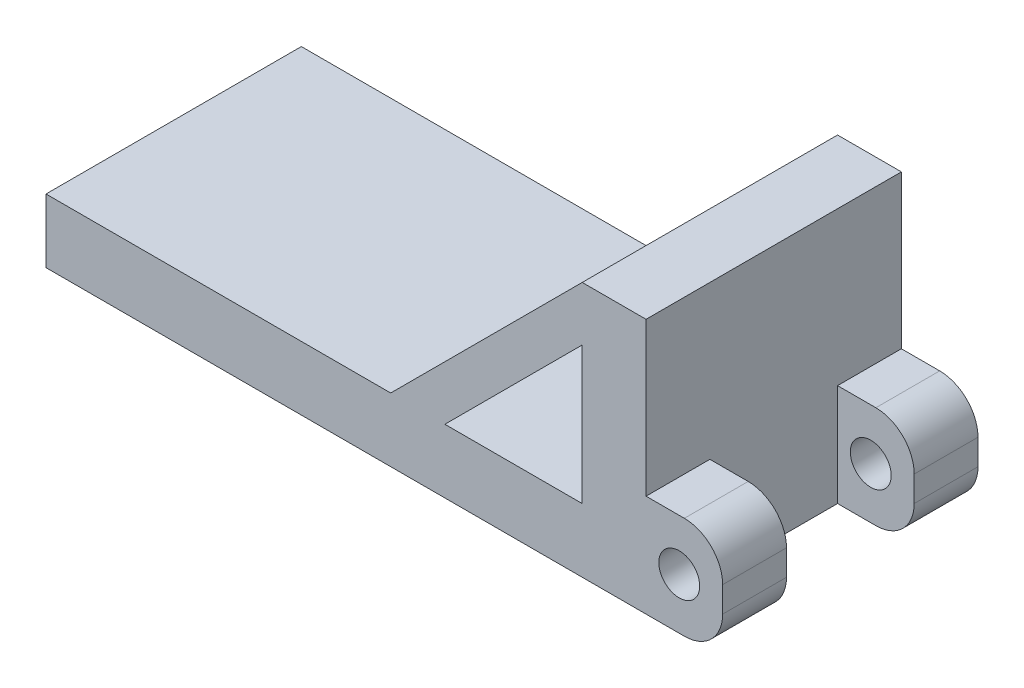
from build123d import *

# Parameters (mm, degrees)
SKETCH2_R           = 1.6
BOSS_EXTRUDE1_DEPTH = 20
FILLET1_R           = 3
CUT_EXTRUDE1_REACH  = 52.685
SKETCH3_W           = 6
SKETCH3_H           = 10


with BuildPart() as part:
    # Sketch2 → Boss-Extrude1 (new body)
    with BuildSketch(Plane.XY):
        Polygon((-45, 0), (0, 0), (8, 0), (8, 8), (2, 8), (2, 20), (-3, 20), (-18, 5), (-45, 5), align=None)
        with Locations((4.6, 4)):
            Circle(SKETCH2_R, mode=Mode.SUBTRACT)
        Polygon((-3, 5), (-13.757359313, 5), (-3, 15.757359313), align=None, mode=Mode.SUBTRACT)
    extrude(amount=BOSS_EXTRUDE1_DEPTH)

    # Fillet1
    fillet1_edges = [part.edges().sort_by_distance(p)[0] for p in [
        (8, 8, 10),
        (8, 0, 10),
    ]]
    fillet(fillet1_edges, radius=FILLET1_R)

    # Sketch3 → Cut-Extrude1 (cut, up to next)
    with BuildSketch(Plane(origin=(0, 8, 0), x_dir=(1, 0, 0), z_dir=(0, 1, 0)), mode=Mode.PRIVATE) as cut_extrude1_sk1:
        with Locations((5, -10)):
            Rectangle(SKETCH3_W, SKETCH3_H)
    cut_extrude1_tool1 = extrude(cut_extrude1_sk1.sketch, amount=-CUT_EXTRUDE1_REACH, mode=Mode.PRIVATE) & part.part
    add(cut_extrude1_tool1.solids().sort_by_distance((5, 8, 10))[0], mode=Mode.SUBTRACT)


solid = part.part
